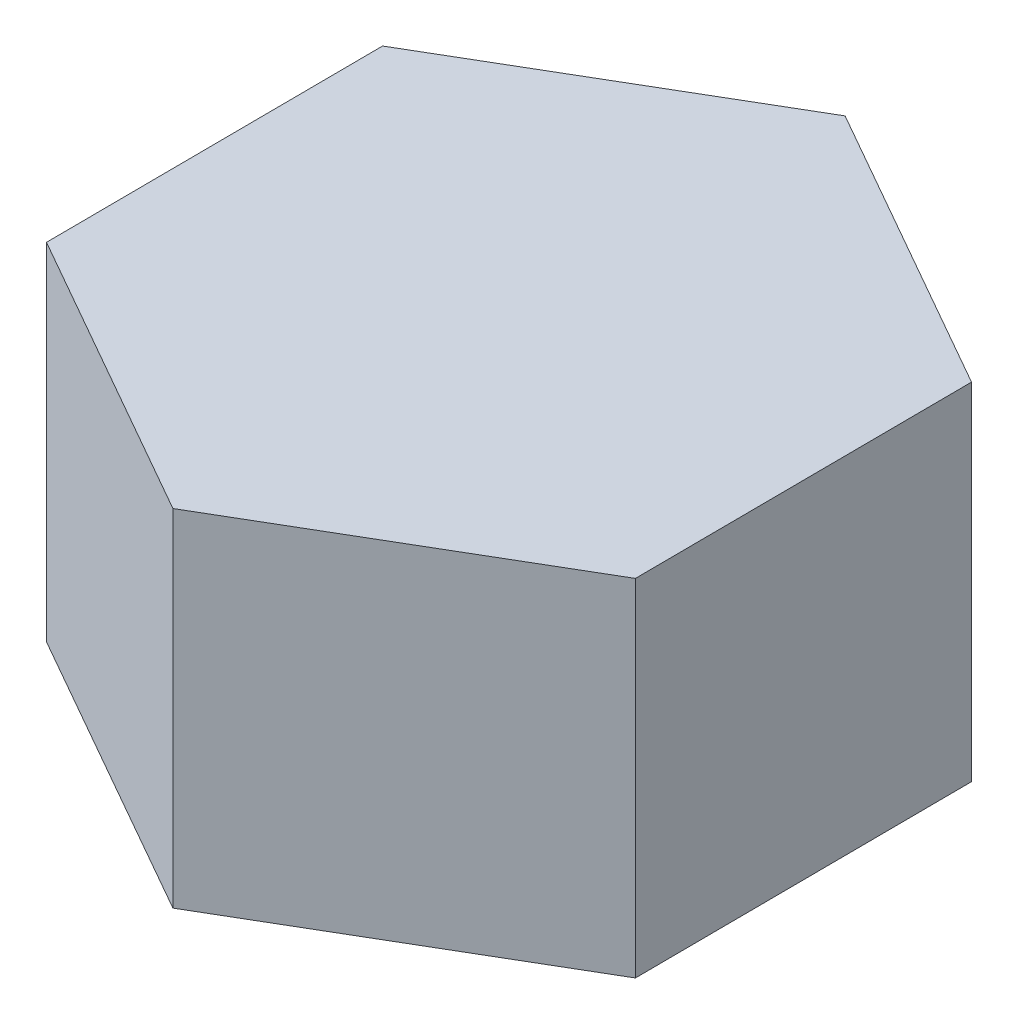
from build123d import *

# Parameters (mm, degrees)
BOSS_EXTRUDE1_DEPTH = 10


with BuildPart() as part:
    # Sketch1 → Boss-Extrude1 (new body)
    with BuildSketch(Plane(origin=(0, 0, 0), x_dir=(1, 0, 0), z_dir=(0, 1, 0))):
        Polygon((8.488282756, -4.835065237), (8.431430702, 4.933535883), (-0.056852054, 9.76860112), (-8.488282756, 4.835065237), (-8.431430702, -4.933535883), (0.056852054, -9.76860112), align=None)
    extrude(amount=BOSS_EXTRUDE1_DEPTH)


solid = part.part
